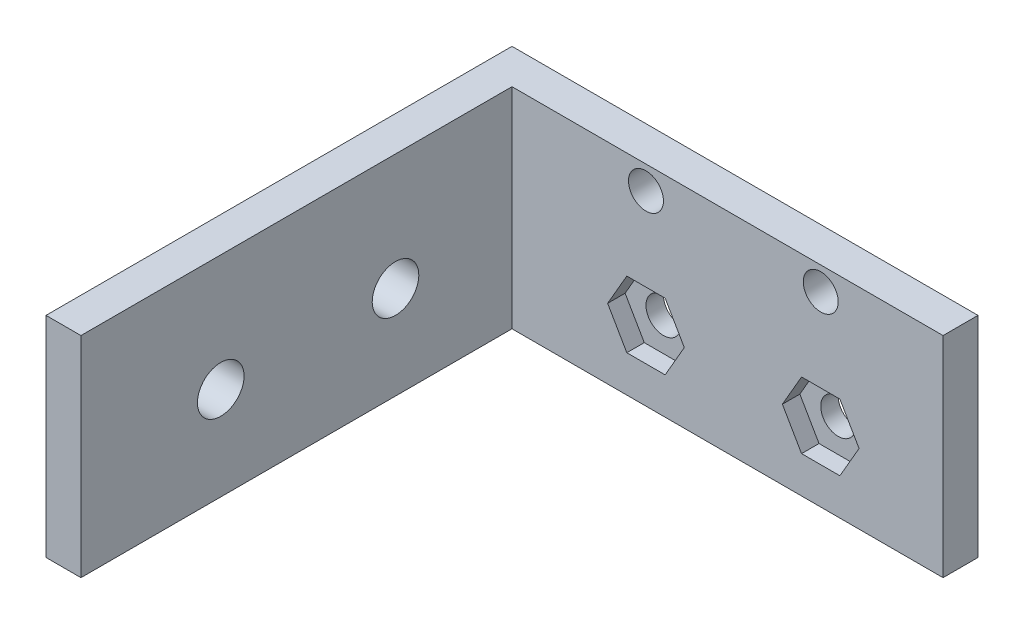
from build123d import *

# Parameters (mm, degrees)
ESQUISSE1_W             = 40
ESQUISSE1_H             = 18
BOSS_EXTRU_1_DEPTH      = 3
ESQUISSE2_W             = 3
ESQUISSE2_H             = 18
BOSS_EXTRU_2_DEPTH      = 37
ESQUISSE3_R             = 1.5
ENL_V_MAT_EXTRU_1_DEPTH = 58.384666942
ESQUISSE4_R             = 2
ENL_V_MAT_EXTRU_2_DEPTH = 58.384666942
ENL_V_MAT_EXTRU_3_DEPTH = 1.5


with BuildPart() as part:
    # Esquisse1 → Boss.-Extru.1 (new body)
    with BuildSketch(Plane.XY):
        with Locations((20, 9)):
            Rectangle(ESQUISSE1_W, ESQUISSE1_H)
    extrude(amount=BOSS_EXTRU_1_DEPTH)

    # Esquisse2 → Boss.-Extru.2 (add)
    with BuildSketch(Plane.XY.offset(3)):
        with Locations((1.5, 9)):
            Rectangle(ESQUISSE2_W, ESQUISSE2_H)
    extrude(amount=BOSS_EXTRU_2_DEPTH)

    # Esquisse3 → Enlèv. mat.-Extru.1 (cut, through all)
    with BuildSketch(Plane.XY.offset(3)):
        with Locations((14.5, 16)):
            Circle(ESQUISSE3_R)
        with Locations((29.5, 16)):
            Circle(ESQUISSE3_R)
        with Locations((14.5, 6)):
            Circle(ESQUISSE3_R)
        with Locations((29.5, 6)):
            Circle(ESQUISSE3_R)
    extrude(amount=-ENL_V_MAT_EXTRU_1_DEPTH, mode=Mode.SUBTRACT)

    # Esquisse4 → Enlèv. mat.-Extru.2 (cut, through all)
    with BuildSketch(Plane(origin=(3, 0, 0), x_dir=(0, 0, -1), z_dir=(1, 0, 0))):
        with Locations(Location((-28, 8, 0), (0, 0, 90))):
            Circle(ESQUISSE4_R)
        with Locations(Location((-13, 8, 0), (0, 0, 90))):
            Circle(ESQUISSE4_R)
    extrude(amount=-ENL_V_MAT_EXTRU_2_DEPTH, mode=Mode.SUBTRACT)

    # Esquisse5 → Enlèv. mat.-Extru.3 (cut)
    with BuildSketch(Plane.XY.offset(3)):
        Polygon((16.145448267, 8.85), (12.854551733, 8.85), (11.209103466, 6), (12.854551733, 3.15), (16.145448267, 3.15), (17.790896534, 6), align=None)
        Polygon((31.145448267, 8.85), (27.854551733, 8.85), (26.209103466, 6), (27.854551733, 3.15), (31.145448267, 3.15), (32.790896534, 6), align=None)
    extrude(amount=-ENL_V_MAT_EXTRU_3_DEPTH, mode=Mode.SUBTRACT)


solid = part.part
